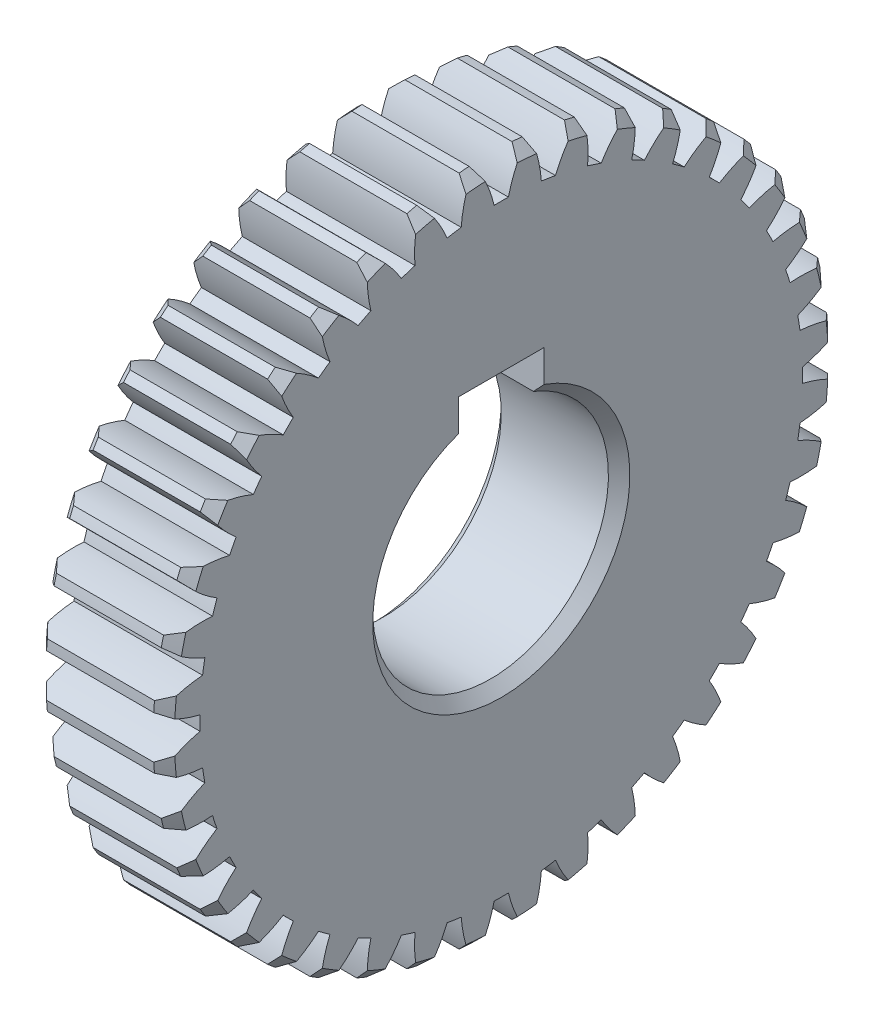
from build123d import *

# Parameters (mm, degrees)
BASPROSKE_W     = 12
BASPROSKE_H     = 31.5
TOOTHCUT_DEPTH  = 47.135669498
TEETHCUTS_COUNT = 40
TEETHCUTS_ANGLE = 351
BORSKE_R        = 11
BORE_DEPTH      = 50.0000508
KEYSKE_W        = 8
KEYSKE_H        = 14.3
KEYWAY_DEPTH    = 50.0000508
CHAMFER1_SIZE   = 1


with BuildPart() as part:
    # BasProSke → Base-Revolve (revolve)
    with BuildSketch(Plane(origin=(0, 0, 0), x_dir=(1, 0, 0), z_dir=(0, 1, 0)), mode=Mode.PRIVATE) as base_revolve_sk:
        with Locations((6, 15.75)):
            Rectangle(BASPROSKE_W, BASPROSKE_H)
    revolve(base_revolve_sk.sketch.rotate(Axis((-10, 0, 0), (1, 0, 0)), 180), axis=Axis((-10, 0, 0), (1, 0, 0)))

    # TooCutSke → ToothCut (cut, through all)
    with BuildSketch(Plane(origin=(0, 0, 0), x_dir=(0, 0, -1), z_dir=(1, 0, 0))):
        with BuildLine():
            ThreePointArc((0.666563357, 28.116099824), (0, 28.124), (-0.666563357, 28.116099824))
            ThreePointArc((-0.666563357, 28.116099824), (-1.215636597, 29.839490209), (-2.017498222, 31.4607779))
            ThreePointArc((-2.017498222, 31.4607779), (0, 31.5254), (2.017498222, 31.4607779))
            ThreePointArc((2.017498222, 31.4607779), (1.215636597, 29.839490209), (0.666563357, 28.116099824))
        make_face()
    toothcut = extrude(amount=TOOTHCUT_DEPTH, mode=Mode.SUBTRACT)

    # TeethCuts: ToothCut ×40 about axis
    teethcuts_axis = Axis((-10, 0, 0), (1, 0, 0))
    for i in range(1, TEETHCUTS_COUNT):
        add(toothcut.rotate(teethcuts_axis, i * TEETHCUTS_ANGLE / (TEETHCUTS_COUNT - 1)), mode=Mode.SUBTRACT)

    # BorSke → Bore (cut, symmetric)
    with BuildSketch(Plane(origin=(0, 0, 0), x_dir=(0, 0, -1), z_dir=(1, 0, 0))):
        with Locations(Location((0, 0, 0), (0, 0, 180))):
            Circle(BORSKE_R)
    extrude(amount=BORE_DEPTH, both=True, mode=Mode.SUBTRACT)

    # KeySke → Keyway (cut, symmetric)
    with BuildSketch(Plane(origin=(0, 0, 0), x_dir=(0, 0, -1), z_dir=(1, 0, 0))):
        with Locations((0, 7.15)):
            Rectangle(KEYSKE_W, KEYSKE_H)
    extrude(amount=KEYWAY_DEPTH, both=True, mode=Mode.SUBTRACT)

    # Chamfer1
    chamfer1_edges = [part.edges().sort_by_distance(p)[0] for p in [
        (12, 31.402896013, -2.471461515),
        (12, 30.629652493, -7.353528961),
        (12, 29.102205274, -12.054528119),
        (12, 26.858165177, -16.458704789),
        (12, 23.952787916, -20.457613522),
        (12, 20.457613522, -23.952787916),
        (12, 16.458704789, -26.858165177),
        (12, 12.05452812, -29.102205274),
        (12, 7.353528961, -30.629652493),
        (12, 2.471461515, -31.402896013),
        (12, -2.471461515, -31.402896013),
        (12, -7.353528961, -30.629652493),
        (12, -12.05452812, -29.102205274),
        (12, -16.458704789, -26.858165177),
        (12, -20.457613522, -23.952787916),
        (12, -23.952787916, -20.457613522),
        (12, -26.858165177, -16.458704789),
        (12, -29.102205274, -12.05452812),
        (12, -30.629652493, -7.353528961),
        (12, -31.402896013, -2.471461515),
        (12, -31.402896013, 2.471461515),
        (12, -30.629652493, 7.353528961),
        (12, -29.102205274, 12.05452812),
        (12, -26.858165177, 16.458704789),
        (12, -23.952787916, 20.457613522),
        (12, -20.457613522, 23.952787916),
        (12, -16.458704789, 26.858165177),
        (12, -12.05452812, 29.102205274),
        (12, -7.353528961, 30.629652493),
        (12, -2.471461515, 31.402896013),
        (12, 2.471461515, 31.402896013),
        (12, 7.353528961, 30.629652493),
        (12, 12.05452812, 29.102205274),
        (12, 16.458704789, 26.858165177),
        (12, 20.457613522, 23.952787916),
        (12, 23.952787916, 20.457613522),
        (12, 26.858165177, 16.458704789),
        (12, 29.102205274, 12.05452812),
        (12, 30.629652493, 7.353528961),
        (0, 31.402896013, 2.471461515),
        (12, 31.402896013, 2.471461515),
        (0, 30.629652493, -7.353528961),
        (0, 29.102205274, -12.05452812),
        (0, 26.858165177, -16.458704789),
        (0, 23.952787916, -20.457613522),
        (0, 20.457613522, -23.952787916),
        (0, 16.458704789, -26.858165177),
        (0, 12.05452812, -29.102205274),
        (0, 7.353528961, -30.629652493),
        (0, 2.471461515, -31.402896013),
        (0, -2.471461515, -31.402896013),
        (0, -7.353528961, -30.629652493),
        (0, -12.05452812, -29.102205274),
        (0, -16.458704789, -26.858165177),
        (0, -20.457613522, -23.952787916),
        (0, -23.952787916, -20.457613522),
        (0, -26.858165177, -16.458704789),
        (0, -29.102205274, -12.05452812),
        (0, -30.629652493, -7.353528961),
        (0, -31.402896013, -2.471461515),
        (0, -31.402896013, 2.471461515),
        (0, -30.629652493, 7.353528961),
        (0, -29.102205274, 12.05452812),
        (0, -26.858165177, 16.458704789),
        (0, -23.952787916, 20.457613522),
        (0, -20.457613522, 23.952787916),
        (0, -16.458704789, 26.858165177),
        (0, -12.05452812, 29.102205274),
        (0, -7.353528961, 30.629652493),
        (0, -2.471461515, 31.402896013),
        (0, 2.471461515, 31.402896013),
        (0, 7.353528961, 30.629652493),
        (0, 12.05452812, 29.102205274),
        (0, 16.458704789, 26.858165177),
        (0, 20.457613522, 23.952787916),
        (0, 23.952787916, 20.457613522),
        (0, 26.858165177, 16.458704789),
        (0, 29.102205274, 12.05452812),
        (0, 30.629652493, 7.353528961),
        (0, -11, 0),
        (12, -11, 0),
        (0, 31.402896013, -2.471461515),
    ]]
    chamfer(chamfer1_edges, length=CHAMFER1_SIZE)


solid = part.part
